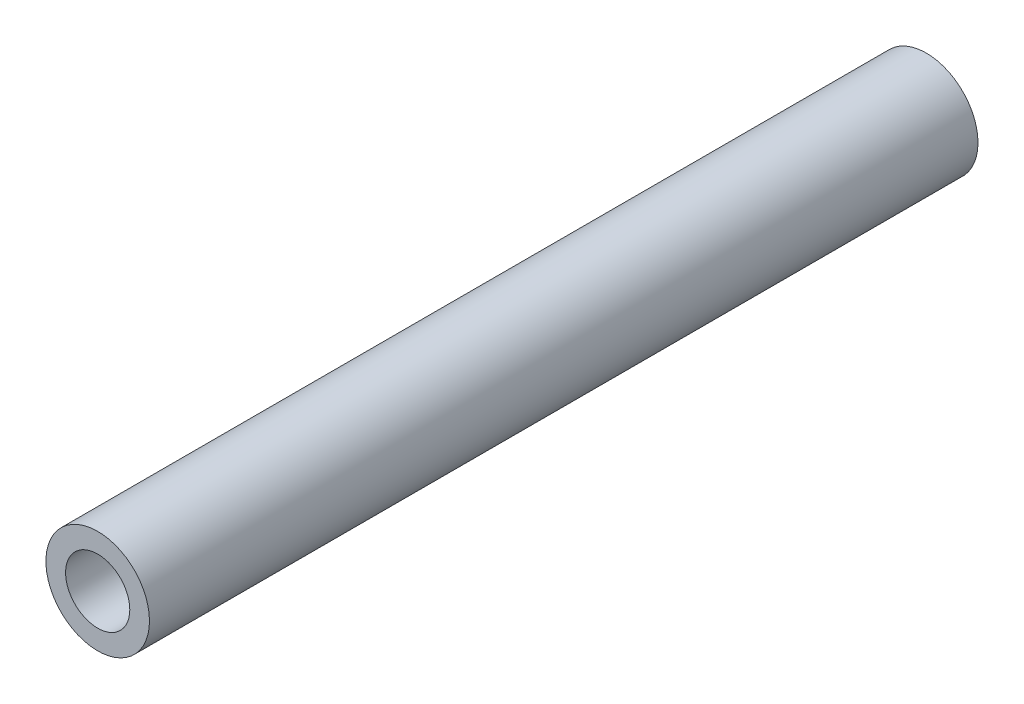
from build123d import *

# Parameters (mm, degrees)
SKETCH_1_R      = 2.5
SKETCH_1_R_2    = 1.55
EXTRUDE_1_DEPTH = 40


with BuildPart() as part:
    # 草图1 → 凸台-拉伸1 (new body)
    with BuildSketch(Plane.XY):
        Circle(SKETCH_1_R)
        Circle(SKETCH_1_R_2, mode=Mode.SUBTRACT)
    extrude(amount=EXTRUDE_1_DEPTH)


solid = part.part
